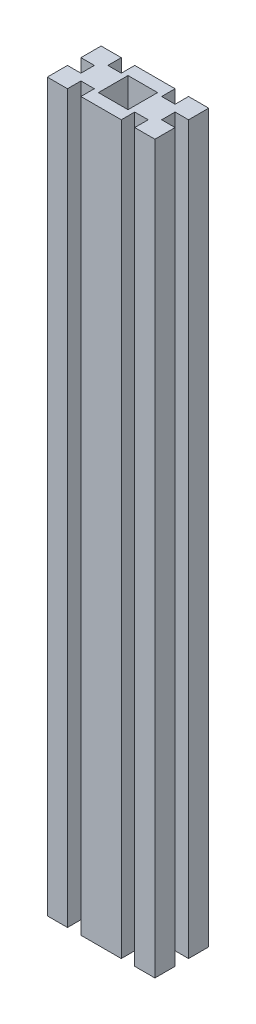
from build123d import *

# Parameters (mm, degrees)
SKETCH1_W       = 40
SKETCH1_H       = 20
BODY_DEPTH      = 270
SKETCH2_W       = 5
SKETCH2_H       = 5
SKETCH2_W_2     = 11
SKETCH2_H_2     = 11
PROFILAGE_DEPTH = 271.924343683


with BuildPart() as part:
    # Sketch1 → Body (new body)
    with BuildSketch(Plane(origin=(0, 0, 0), x_dir=(1, 0, 0), z_dir=(0, 1, 0))):
        Rectangle(SKETCH1_W, SKETCH1_H)
    extrude(amount=BODY_DEPTH)

    # Sketch2 → Profilage (cut, through all)
    with BuildSketch(Plane(origin=(0, 270, 0), x_dir=(1, 0, 0), z_dir=(0, 1, 0))):
        with Locations((-10, 7.5)):
            Rectangle(SKETCH2_W, SKETCH2_H)
        with Locations((-17.5, 0)):
            Rectangle(SKETCH2_W, SKETCH2_H)
        with Locations((-10, -7.5)):
            Rectangle(SKETCH2_W, SKETCH2_H)
        with Locations((10, -7.5)):
            Rectangle(SKETCH2_W, SKETCH2_H)
        with Locations((17.5, 0)):
            Rectangle(SKETCH2_W, SKETCH2_H)
        with Locations((10, 7.5)):
            Rectangle(SKETCH2_W, SKETCH2_H)
        Rectangle(SKETCH2_W_2, SKETCH2_H_2)
    extrude(amount=-PROFILAGE_DEPTH, mode=Mode.SUBTRACT)


solid = part.part
